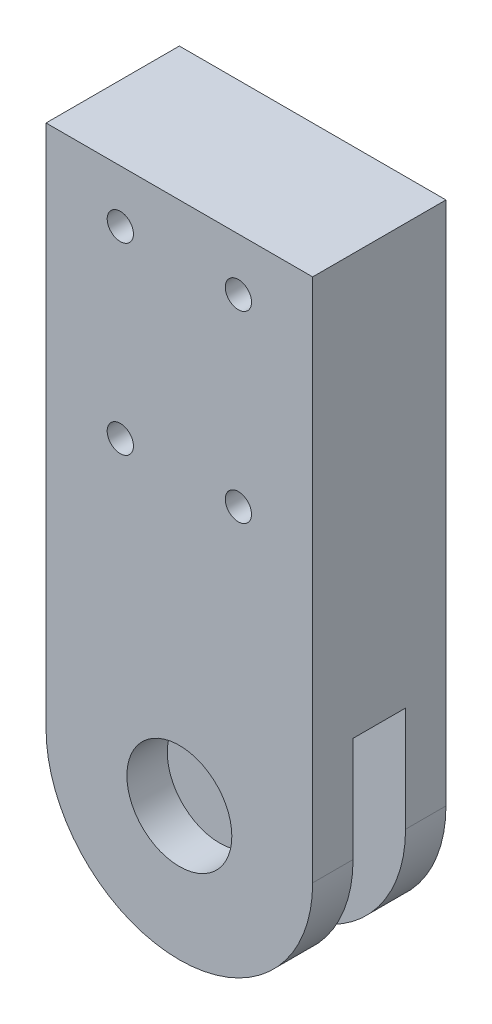
from build123d import *

# Parameters (mm, degrees)
SKETCH1_R           = 10
BOSS_EXTRUDE1_DEPTH = 25.4
SKETCH2_W           = 10
SKETCH2_H           = 45.4
CUT_EXTRUDE1_DEPTH  = 116.003478208
SKETCH3_R           = 2.5
CUT_EXTRUDE2_DEPTH  = 107.255917482


with BuildPart() as part:
    # Sketch1 → Boss-Extrude1 (new body)
    with BuildSketch(Plane.XY):
        with BuildLine():
            Line((-25.4, 0), (-25.4, 100))
            Line((-25.4, 100), (25.4, 100))
            Line((25.4, 100), (25.4, 0))
            ThreePointArc((25.4, 0), (0, -25.4), (-25.4, 0))
        make_face()
        Circle(SKETCH1_R, mode=Mode.SUBTRACT)
    extrude(amount=BOSS_EXTRUDE1_DEPTH)

    # Sketch2 → Cut-Extrude1 (cut, through all)
    with BuildSketch(Plane.ZY.offset(25.4)):
        with Locations((12.7, -2.7)):
            Rectangle(SKETCH2_W, SKETCH2_H)
    extrude(amount=-CUT_EXTRUDE1_DEPTH, mode=Mode.SUBTRACT)

    # Sketch3 → Cut-Extrude2 (cut, through all)
    with BuildSketch(Plane.XY.offset(25.4)):
        with Locations((-11.25, 90)):
            Circle(SKETCH3_R)
        with Locations((11.25, 90)):
            Circle(SKETCH3_R)
        with Locations((11.25, 55)):
            Circle(SKETCH3_R)
        with Locations((-11.25, 55)):
            Circle(SKETCH3_R)
    extrude(amount=-CUT_EXTRUDE2_DEPTH, mode=Mode.SUBTRACT)


solid = part.part
